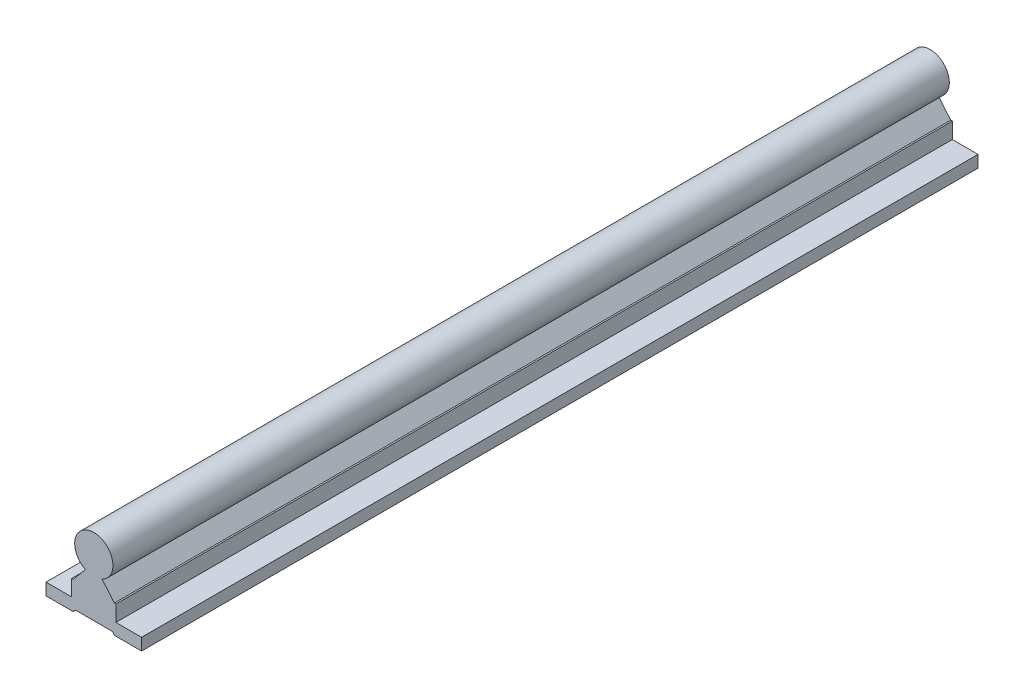
from build123d import *

# Parameters (mm, degrees)
DODANIE_WYCI_GNI_CIE1_DEPTH = 350


with BuildPart() as part:
    # Szkic1 → Dodanie-wyciągnięcie1 (new body)
    with BuildSketch(Plane.XY):
        with BuildLine():
            Line((-3.487119155, 17.8), (-8.605626905, 11.7))
            Line((-8.605626905, 11.7), (-9.25, 11.7))
            Line((-9.25, 11.7), (-9.25, 5))
            Line((-9.25, 5), (-20, 5))
            Line((-20, 5), (-20, 0))
            Line((-20, 0), (-8.605626905, 0))
            Line((-8.605626905, 0), (-7.766527274, 1))
            Line((-7.766527274, 1), (7.766527274, 1))
            Line((7.766527274, 1), (8.605626905, 0))
            Line((8.605626905, 0), (20, 0))
            Line((20, 0), (20, 5))
            Line((20, 5), (9.25, 5))
            Line((9.25, 5), (9.25, 11.7))
            Line((9.25, 11.7), (8.605626905, 11.7))
            Line((8.605626905, 11.7), (3.487119155, 17.8))
            ThreePointArc((3.487119155, 17.8), (0, 33), (-3.487119155, 17.8))
        make_face()
    extrude(amount=DODANIE_WYCI_GNI_CIE1_DEPTH)


solid = part.part
